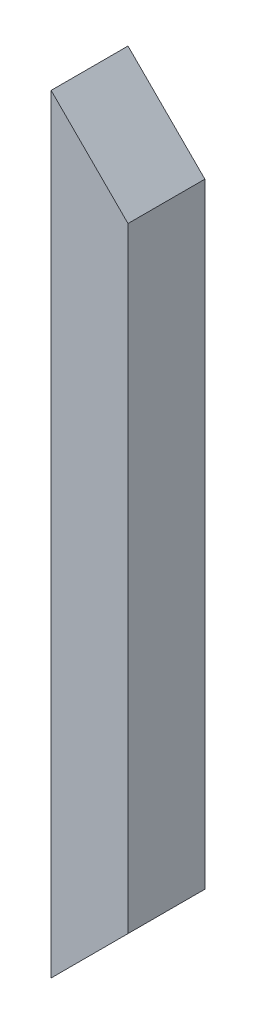
from build123d import *

# Parameters (mm, degrees)
SKETCH_1_W          = 50
SKETCH_1_H          = 50
EXTRUDE_2_DEPTH     = 500
CUT_EXTRUDE_2_DEPTH = 50


with BuildPart() as part:
    # Эскиз1 → Бобышка-Вытянуть2 (new body)
    with BuildSketch(Plane(origin=(0, 0, 0), x_dir=(1, 0, 0), z_dir=(0, 1, 0))):
        Rectangle(SKETCH_1_W, SKETCH_1_H)
    extrude(amount=EXTRUDE_2_DEPTH)

    # Эскиз2 → Вырез-Вытянуть2 (cut)
    with BuildSketch(Plane.XY.offset(25)):
        Polygon((-25, 500), (25, 450), (25, 500), align=None)
        Polygon((-25, 0), (25, 50), (25, 0), align=None)
    extrude(amount=-CUT_EXTRUDE_2_DEPTH, mode=Mode.SUBTRACT)


solid = part.part
